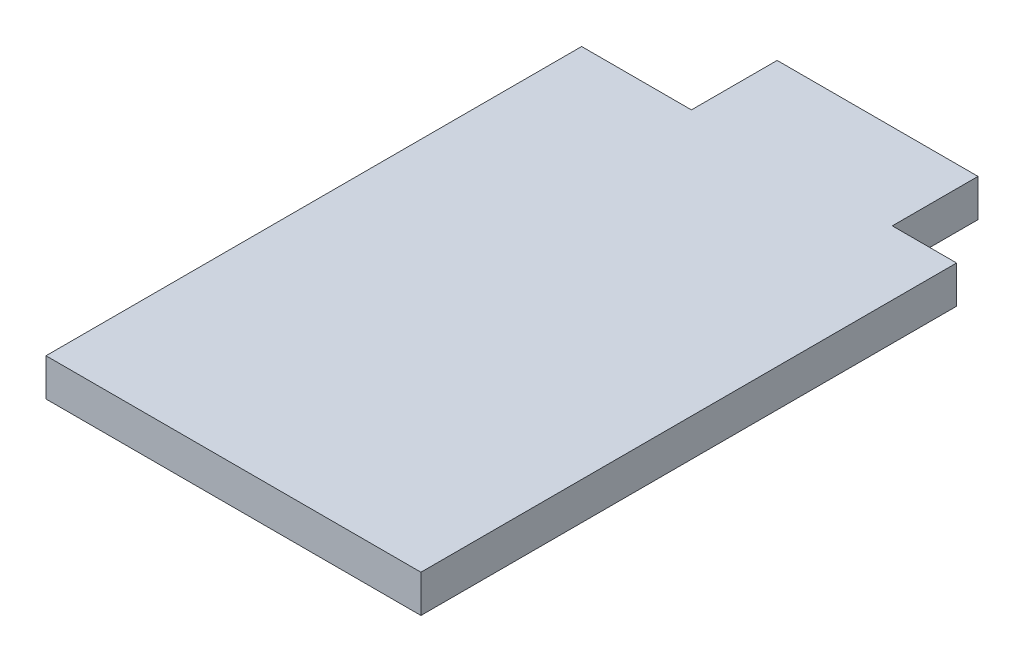
from build123d import *

# Parameters (mm, degrees)
SKETCH1_W           = 70
SKETCH1_H           = 100
BOSS_EXTRUDE1_DEPTH = 7
SKETCH2_R           = 1.5
CUT_EXTRUDE1_DEPTH  = 5
SKETCH3_W           = 37.5
SKETCH3_H           = 16
BOSS_EXTRUDE2_DEPTH = 7


with BuildPart() as part:
    # Sketch1 → Boss-Extrude1 (new body)
    with BuildSketch(Plane(origin=(0, 0, 0), x_dir=(1, 0, 0), z_dir=(0, 1, 0))):
        Rectangle(SKETCH1_W, SKETCH1_H)
    extrude(amount=BOSS_EXTRUDE1_DEPTH)

    # Sketch2 → Cut-Extrude1 (cut)
    with BuildSketch(Plane.XZ):
        with Locations(Location((-30.5, -36.5, 0), (0, 0, 270))):
            Circle(SKETCH2_R)
        with Locations(Location((-30.5, 39.5, 0), (0, 0, 270))):
            Circle(SKETCH2_R)
        with Locations(Location((30.5, 39.5, 0), (0, 0, 270))):
            Circle(SKETCH2_R)
        with Locations(Location((30.5, -36.5, 0), (0, 0, 270))):
            Circle(SKETCH2_R)
    extrude(amount=-CUT_EXTRUDE1_DEPTH, mode=Mode.SUBTRACT)

    # Sketch3 → Boss-Extrude2 (add)
    with BuildSketch(Plane.XZ):
        with Locations((4.25, -58)):
            Rectangle(SKETCH3_W, SKETCH3_H)
    extrude(amount=-BOSS_EXTRUDE2_DEPTH)


solid = part.part
